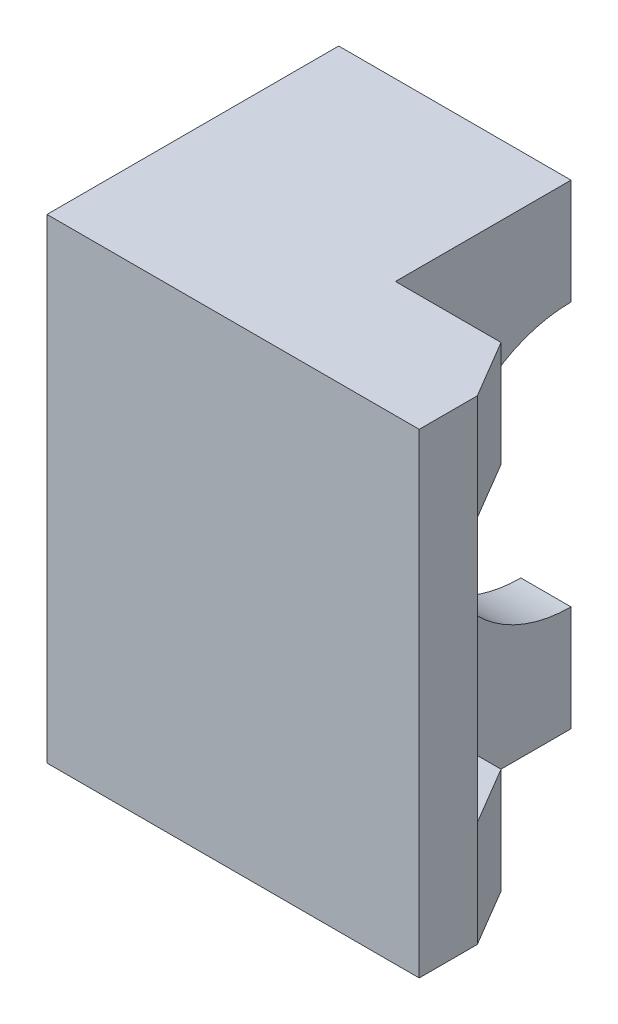
from build123d import *

# Parameters (mm, degrees)
BOSS_EXTRUDE1_DEPTH     = 90
CUT_EXTRUDE6_DEPTH      = 115.405255561
CUT_EXTRUDE6_DEPTH_BACK = 44
SKETCH8_W               = 25
SKETCH8_H               = 15
CUT_EXTRUDE9_DEPTH      = 15
SKETCH13_W              = 16.5
SKETCH13_H              = 50
CUT_EXTRUDE18_DEPTH     = 11


with BuildPart() as part:
    # Sketch1 → Boss-Extrude1 (new body)
    with BuildSketch(Plane(origin=(0, 0, 0), x_dir=(1, 0, 0), z_dir=(0, 1, 0))):
        Polygon((0, 0), (70.5, 0), (70.5, 11), (64, 22), (44, 22), (44, 55.25), (0, 55.25), align=None)
    extrude(amount=BOSS_EXTRUDE1_DEPTH)

    # Sketch7 → Cut-Extrude6 (cut, two sides: drawn at the far end of the back side and taken through both)
    with BuildSketch(Plane(origin=(44, 0, 0), x_dir=(0, 0, -1), z_dir=(1, 0, 0)).offset(-CUT_EXTRUDE6_DEPTH_BACK)):
        with BuildLine():
            Line((243.604282259, 20), (55.25, 20))
            ThreePointArc((55.25, 20), (30.25, 45), (55.25, 70))
            Line((55.25, 70), (243.604282259, 70))
            Line((243.604282259, 70), (620.312846776, 70))
            Line((620.312846776, 70), (620.312846776, 20))
            Line((620.312846776, 20), (243.604282259, 20))
        make_face()
    extrude(amount=CUT_EXTRUDE6_DEPTH + CUT_EXTRUDE6_DEPTH_BACK, mode=Mode.SUBTRACT)

    # Sketch8 → Cut-Extrude9 (cut)
    with BuildSketch(Plane(origin=(0, 0, -55.25), x_dir=(-1, 0, 0), z_dir=(0, 0, -1))):
        with Locations((-22, 71)):
            Rectangle(SKETCH8_W, SKETCH8_H)
        with Locations((-22, 19)):
            Rectangle(SKETCH8_W, SKETCH8_H)
    extrude(amount=-CUT_EXTRUDE9_DEPTH, mode=Mode.SUBTRACT)

    # Sketch13 → Cut-Extrude18 (cut)
    with BuildSketch(Plane(origin=(0, 0, -22), x_dir=(-1, 0, 0), z_dir=(0, 0, -1))):
        with Locations((-62.25, 45)):
            Rectangle(SKETCH13_W, SKETCH13_H)
    extrude(amount=-CUT_EXTRUDE18_DEPTH, mode=Mode.SUBTRACT)


solid = part.part
